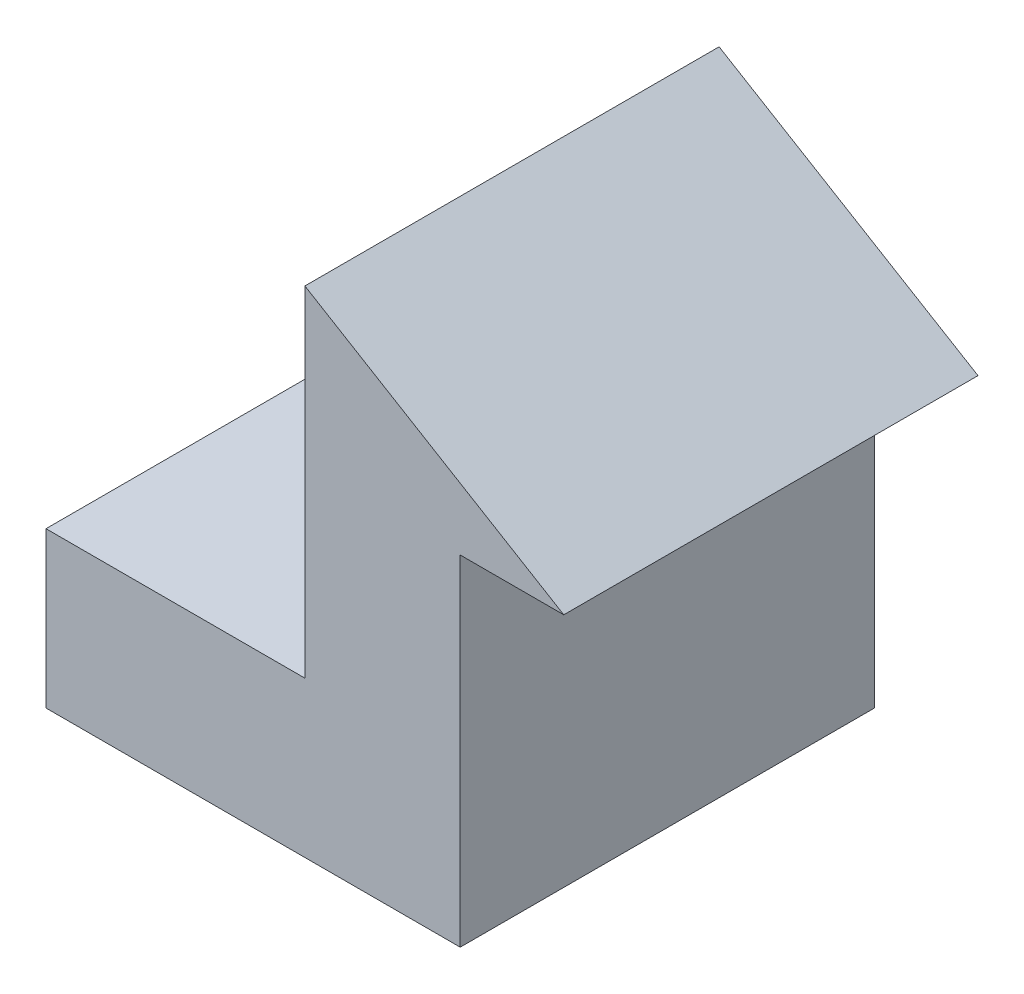
from build123d import *

# Parameters (mm, degrees)
BOSS_EXTRU_1_DEPTH = 40


with BuildPart() as part:
    # Esquisse1 → Boss.-Extru.1 (new body)
    with BuildSketch(Plane.XY):
        Polygon((50, 32.8), (25, 47.8), (25, 15), (0, 15), (0, 0), (40, 0), (40, 32.8), align=None)
    extrude(amount=BOSS_EXTRU_1_DEPTH)


solid = part.part
